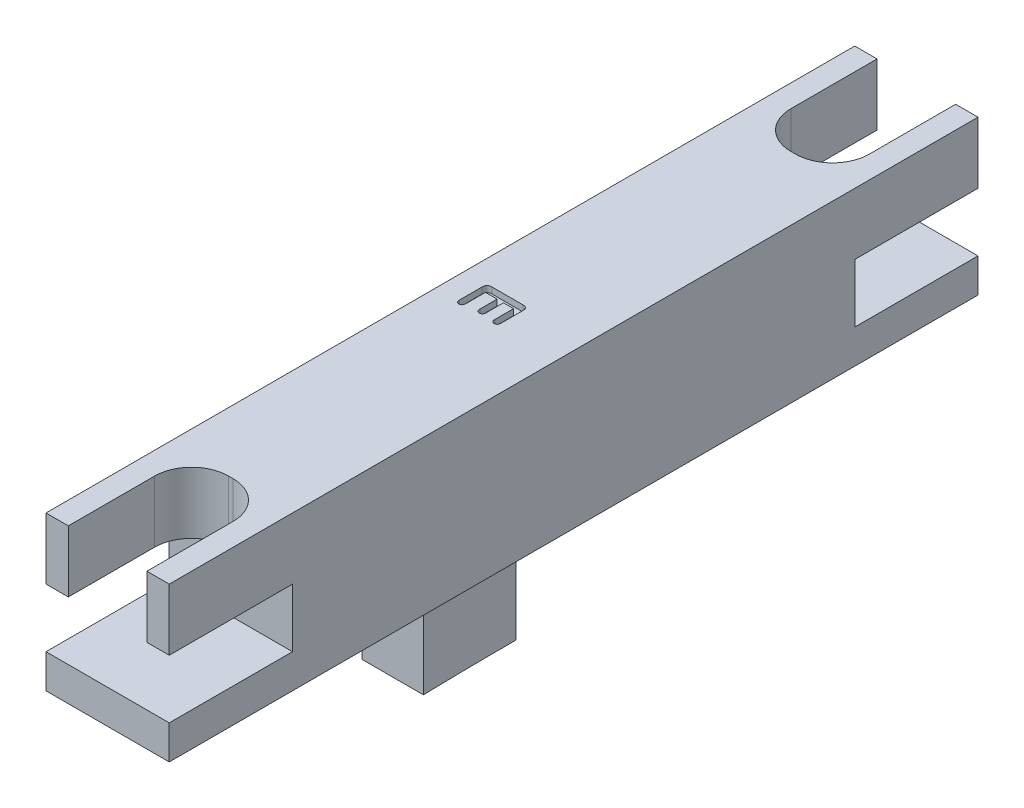
from build123d import *

# Parameters (mm, degrees)
SKETCH2_W            = 10.16
SKETCH2_H            = 66.675
BOSS_EXTRUDE1_DEPTH  = 12.7
SKETCH3_W            = 5.08
SKETCH3_H            = 6.35
SKETCH3_H_2          = 1.27
BOSS_EXTRUDE2_DEPTH  = 12.7
CUT_EXTRUDE1_DEPTH   = 10.16
FILLET2_R            = 3.048
FILLET2_OF_MIRROR1_R = 3.048
CUT_EXTRUDE4_DEPTH   = 69.629958655
CUT_EXTRUDE5_DEPTH   = 0.508


with BuildPart() as part:
    # Sketch2 → Boss-Extrude1 (new body)
    with BuildSketch(Plane(origin=(0, 0, 0), x_dir=(1, 0, 0), z_dir=(0, 1, 0))):
        with Locations((5.08, 33.3375)):
            Rectangle(SKETCH2_W, SKETCH2_H)
    extrude(amount=BOSS_EXTRUDE1_DEPTH)

    # Sketch3 → Boss-Extrude2 (add)
    with BuildSketch(Plane.XZ):
        with Locations((2.54, -29.21)):
            Rectangle(SKETCH3_W, SKETCH3_H)
        with Locations((2.54, -33.02)):
            Rectangle(SKETCH3_W, SKETCH3_H_2)
    extrude(amount=BOSS_EXTRUDE2_DEPTH)

    # Sketch4 → Cut-Extrude1 (cut)
    with BuildSketch(Plane.XY):
        Polygon((0, 7.62), (1.8415, 7.62), (1.8415, 12.7), (8.3185, 12.7), (8.3185, 7.62), (10.16, 7.62), (10.16, 2.794), (0, 2.794), align=None)
    cut_extrude1 = extrude(amount=-CUT_EXTRUDE1_DEPTH, mode=Mode.SUBTRACT)

    # Fillet2
    fillet2_edges = [part.edges().sort_by_distance(p)[0] for p in [
        (1.8415, 10.16, -10.16),
        (8.3185, 10.16, -10.16),
    ]]
    fillet(fillet2_edges, radius=FILLET2_R)

    # Mirror1: Cut-Extrude1 across plane
    add(cut_extrude1.mirror(Plane.XY.offset(-33.3375)), mode=Mode.SUBTRACT)

    # Fillet2 of Mirror1
    fillet2_of_mirror1_edges = [part.edges().sort_by_distance(p)[0] for p in [
        (1.8415, 10.16, -56.515),
        (8.3185, 10.16, -56.515),
    ]]
    fillet(fillet2_of_mirror1_edges, radius=FILLET2_OF_MIRROR1_R)

    # Sketch5 → Cut-Extrude4 (cut, through all)
    with BuildSketch(Plane.ZY):
        with BuildLine():
            Line((-66.675, -12.7), (0, -12.7))
            ThreePointArc((0, -12.7), (-33.3375, -10.668), (-66.675, -12.7))
        make_face()
    extrude(amount=-CUT_EXTRUDE4_DEPTH, mode=Mode.SUBTRACT)

    # Sketch6 → Cut-Extrude5 (cut)
    with BuildSketch(Plane(origin=(0, 12.7, 0), x_dir=(1, 0, 0), z_dir=(0, 1, 0))):
        with BuildLine():
            Line((4.68525, 32.318945312), (4.68525, 33.8625))
            Line((4.68525, 33.8625), (3.854, 33.8625))
            Line((3.854, 33.8625), (3.854, 32.441308594))
            add(Edge.make_bspline(
                [(3.854, 32.441308594), (3.85306664, 32.416646376), (3.85131467, 32.370353963), (3.838922285, 32.305553354), (3.816176667, 32.250750116), (3.784435917, 32.206165385), (3.744958065, 32.171924109), (3.699953428, 32.146753392), (3.648447348, 32.132038096), (3.612331739, 32.130427428), (3.593550781, 32.129589844)],
                knots=[0, 0, 0, 0, 1.285293232, 2.412569968, 3.418386025, 4.354403319, 5.23810445, 6.120527863, 7.022630715, 8, 8, 8, 8], degree=3))
            add(Edge.make_bspline(
                [(3.593550781, 32.129589844), (3.574749437, 32.130386162), (3.538594625, 32.131917475), (3.487376628, 32.147184911), (3.441067547, 32.170468115), (3.400708139, 32.204601131), (3.368216057, 32.249315164), (3.344656766, 32.304313536), (3.331515928, 32.36960597), (3.329873624, 32.416410782), (3.329, 32.441308594)],
                knots=[0, 0, 0, 0, 0.970712631, 1.866671451, 2.742370236, 3.637940775, 4.57451605, 5.578136324, 6.711690039, 8, 8, 8, 8], degree=3))
            Line((3.329, 32.441308594), (3.329, 33.8625))
            Line((3.329, 33.8625), (2.3665, 33.8625))
            Line((2.3665, 33.8625), (2.3665, 32.265625))
            add(Edge.make_bspline(
                [(2.3665, 32.265625), (2.3655501, 32.240286731), (2.363764391, 32.192653494), (2.351476637, 32.125480995), (2.328025391, 32.068668897), (2.296333649, 32.021515895), (2.256316564, 31.985404245), (2.210438968, 31.958523559), (2.157768886, 31.943480459), (2.120952669, 31.941339483), (2.101949219, 31.940234375)],
                knots=[0, 0, 0, 0, 1.282115211, 2.410239491, 3.433544999, 4.370413449, 5.259840111, 6.137762651, 7.038767785, 8, 8, 8, 8], degree=3))
            add(Edge.make_bspline(
                [(2.101949219, 31.940234375), (2.083387815, 31.94130204), (2.047657894, 31.943357251), (1.99647574, 31.958830307), (1.951565967, 31.985590419), (1.911713519, 32.021521306), (1.879780454, 32.068510842), (1.857617463, 32.125745925), (1.843908263, 32.192526909), (1.842335714, 32.24025854), (1.8415, 32.265625)],
                knots=[0, 0, 0, 0, 0.94634305, 1.821670557, 2.697075277, 3.594139625, 4.539053153, 5.56674892, 6.706875008, 8, 8, 8, 8], degree=3))
            Line((1.8415, 32.265625), (1.8415, 34.116796875))
            add(Edge.make_bspline(
                [(1.8415, 34.116796875), (1.842466239, 34.150170648), (1.844264303, 34.212275576), (1.862680376, 34.298270852), (1.892787961, 34.369951249), (1.937907595, 34.427362709), (1.998445006, 34.469083716), (2.072427477, 34.499358574), (2.16166782, 34.515384672), (2.225621192, 34.517576552), (2.259859375, 34.51875)],
                knots=[0, 0, 0, 0, 1.189944925, 2.214356848, 3.121275872, 3.943259729, 4.783004917, 5.7166381, 6.777575619, 8, 8, 8, 8], degree=3))
            Line((2.259859375, 34.51875), (4.791890625, 34.51875))
            add(Edge.make_bspline(
                [(4.791890625, 34.51875), (4.81537587, 34.518197938), (4.859971724, 34.517149635), (4.923783566, 34.510060607), (4.980566831, 34.496281007), (5.031331248, 34.478007659), (5.075573059, 34.45409369), (5.113745466, 34.424163537), (5.144476669, 34.387304712), (5.169662361, 34.344901006), (5.187624682, 34.296110527), (5.20161385, 34.241903477), (5.208592234, 34.181233065), (5.209681005, 34.138913293), (5.21025, 34.116796875)],
                knots=[0, 0, 0, 0, 1.25760687, 2.388054849, 3.429687073, 4.379296607, 5.269270079, 6.111463577, 6.959732887, 7.823909447, 8.739278143, 9.733531743, 10.815538057, 12, 12, 12, 12], degree=3))
            Line((5.21025, 34.116796875), (5.21025, 32.318945312))
            add(Edge.make_bspline(
                [(5.21025, 32.318945312), (5.209294138, 32.293380123), (5.207496341, 32.245296836), (5.195306163, 32.177659161), (5.1719504, 32.120727753), (5.140037158, 32.074132036), (5.100434178, 32.038946704), (5.055076035, 32.013331032), (5.003864768, 31.998014319), (4.967678458, 31.99642215), (4.949117187, 31.995605469)],
                knots=[0, 0, 0, 0, 1.303543407, 2.451718649, 3.482873774, 4.417375591, 5.305837532, 6.158811619, 7.05558772, 8, 8, 8, 8], degree=3))
            add(Edge.make_bspline(
                [(4.949117187, 31.995605469), (4.930090551, 31.996389194), (4.893210146, 31.997908334), (4.841038001, 32.013538139), (4.794569462, 32.03849449), (4.754855556, 32.074202728), (4.722711227, 32.120560462), (4.700417628, 32.177846336), (4.68793119, 32.245265971), (4.686180707, 32.293369409), (4.68525, 32.318945312)],
                knots=[0, 0, 0, 0, 0.961524532, 1.863777426, 2.731626687, 3.61454628, 4.543218546, 5.563575511, 6.704588277, 8, 8, 8, 8], degree=3))
        make_face()
    extrude(amount=-CUT_EXTRUDE5_DEPTH, mode=Mode.SUBTRACT)


solid = part.part
